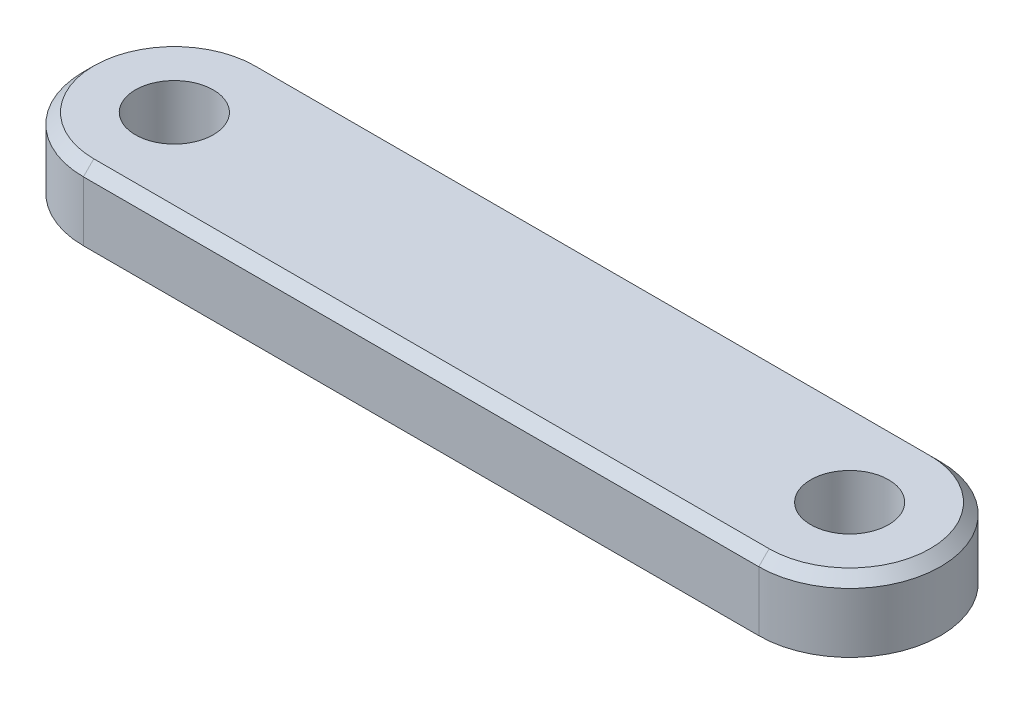
from build123d import *

# Parameters (mm, degrees)
SKETCH1_R           = 1.5
BOSS_EXTRUDE1_DEPTH = 1.35
CHAMFER1_SIZE       = 0.4


with BuildPart() as part:
    # Sketch1 → Boss-Extrude1 (new, symmetric)
    with BuildSketch(Plane(origin=(0, 0, 0), x_dir=(1, 0, 0), z_dir=(0, 1, 0))):
        with BuildLine():
            Line((-13, 3.5), (13, 3.5))
            ThreePointArc((13, 3.5), (16.5, 0), (13, -3.5))
            Line((13, -3.5), (-13, -3.5))
            ThreePointArc((-13, -3.5), (-16.5, 0), (-13, 3.5))
        make_face()
        with Locations(Location((-13, 0, 0), (0, 0, 90))):
            Circle(SKETCH1_R, mode=Mode.SUBTRACT)
        with Locations(Location((13, 0, 0), (0, 0, 90))):
            Circle(SKETCH1_R, mode=Mode.SUBTRACT)
    extrude(amount=BOSS_EXTRUDE1_DEPTH, both=True)

    # Chamfer1
    chamfer1_edges = [part.edges().sort_by_distance(p)[0] for p in [
        (16.5, 1.35, 0),
        (0, 1.35, -3.5),
        (-16.5, 1.35, 0),
        (0, 1.35, 3.5),
    ]]
    chamfer(chamfer1_edges, length=CHAMFER1_SIZE)


solid = part.part
